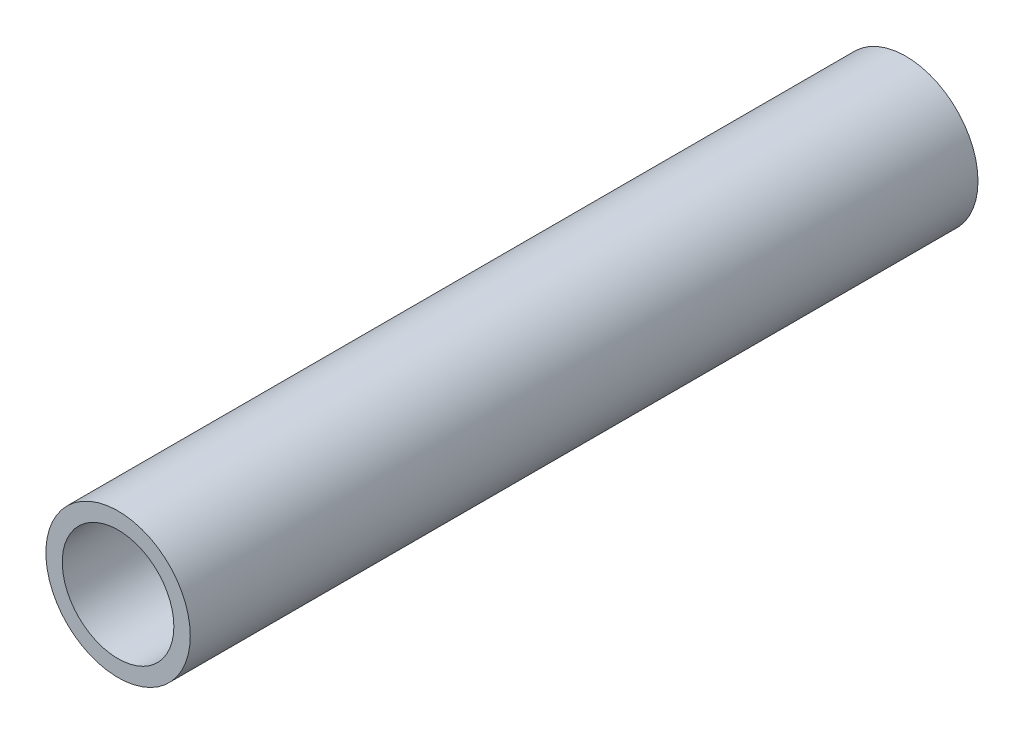
from build123d import *

# Parameters (mm, degrees)
SKETCH1_R           = 11
SKETCH1_R_2         = 8.5
BOSS_EXTRUDE1_DEPTH = 120


with BuildPart() as part:
    # Sketch1 → Boss-Extrude1 (new body)
    with BuildSketch(Plane.XY):
        Circle(SKETCH1_R)
        Circle(SKETCH1_R_2, mode=Mode.SUBTRACT)
    extrude(amount=BOSS_EXTRUDE1_DEPTH)


solid = part.part
